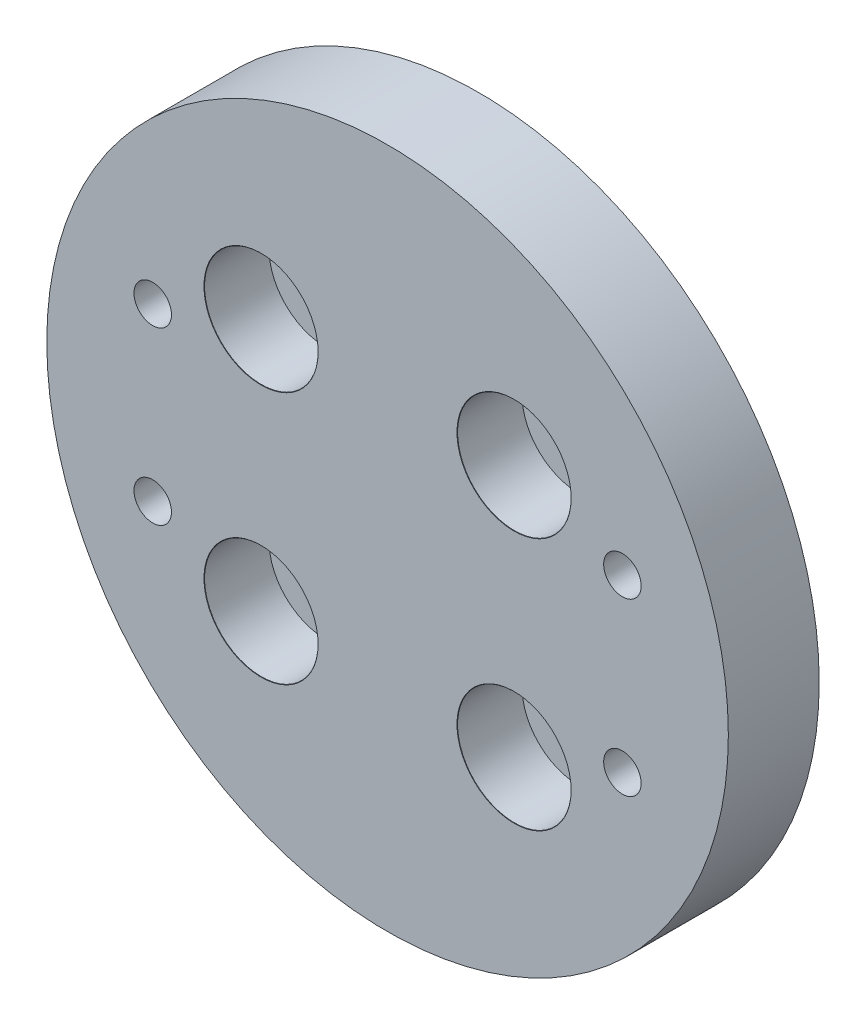
from build123d import *

# Parameters (mm, degrees)
SKETCH_1_R               = 30
EXTRUDE_1_DEPTH          = 8
PATTERN_CIRCULAR_1_COUNT = 4
HOLE_WIZARD_M4_1_D       = 3.3


with BuildPart() as part:
    # 草图1 → 凸台-拉伸1 (new body)
    with BuildSketch(Plane.XY):
        Circle(SKETCH_1_R)
    extrude(amount=EXTRUDE_1_DEPTH)

    # 草图7 → 打孔尺寸(%根据)内六角圆柱头螺钉的类型1 (revolve, cut)
    with BuildSketch(Plane(origin=(11.136931804, -11.136931804, 8), x_dir=(0, -1, 0), z_dir=(1, 0, 0))):
        Polygon((0, 0), (0, 8), (2.75, 8), (2.75, 5.7), (5, 5.7), (5, 0.025), (5.025, 0), align=None)
    hole_wizard_1 = revolve(axis=Axis((11.136931804, -11.136931804, 14.35), (0, 0, -1)), mode=Mode.SUBTRACT)

    # 阵列(圆周)1: 打孔尺寸(%根据)内六角圆柱头螺钉的类型1 ×4 about axis
    pattern_circular_1_axis = Axis((0, 0, 0), (0, 0, 1))
    for i in range(1, PATTERN_CIRCULAR_1_COUNT):
        add(hole_wizard_1.rotate(pattern_circular_1_axis, i * 360 / PATTERN_CIRCULAR_1_COUNT), mode=Mode.SUBTRACT)

    # M4 螺纹孔1 (through all)
    with Locations(Plane.XY.offset(8)):
        with Locations((20.673237657, 7.524443153), (20.673237657, -7.524443153), (-20.673237657, 7.524443153), (-20.673237657, -7.524443153)):
            Hole(HOLE_WIZARD_M4_1_D / 2)


solid = part.part
